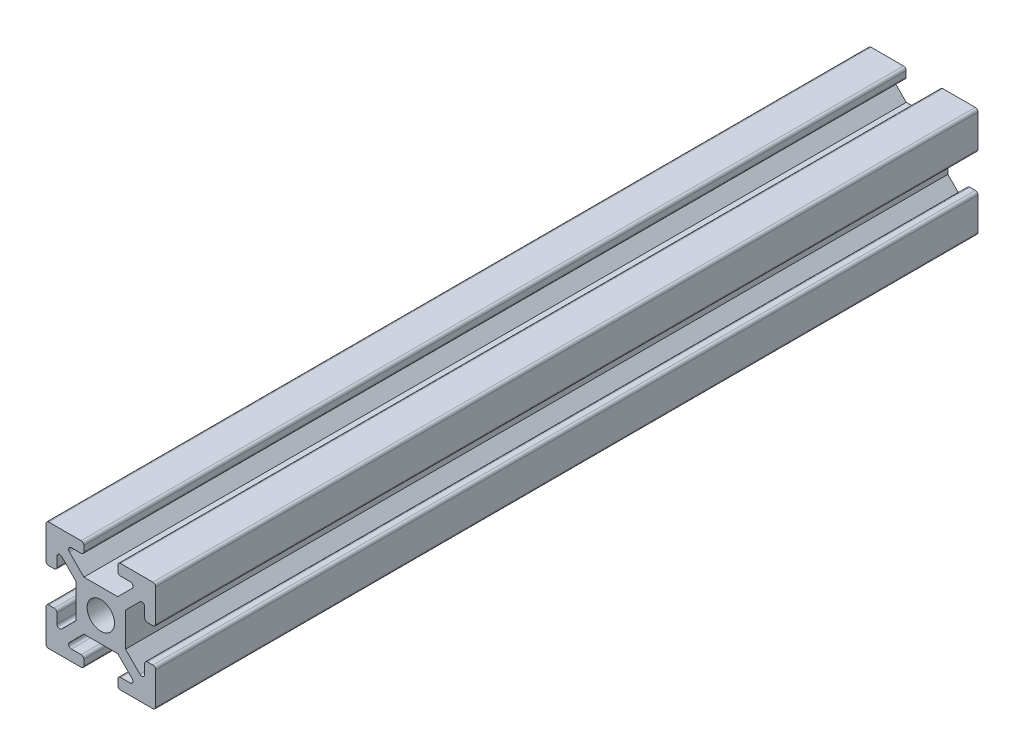
from build123d import *

# Parameters (mm, degrees)
AUFSATZ_LINEAR_AUSTRAGEN1_DEPTH = 150
VERRUNDUNG1_R                   = 0.5
KREISMUSTER1_COUNT              = 4
SKIZZE3_W                       = 9
SKIZZE3_H                       = 9
AUFSATZ_LINEAR_AUSTRAGEN2_DEPTH = 150
SKIZZE4_R                       = 2.5
SCHNITT_LINEAR_AUSTRAGEN1_DEPTH = 151.665191733


with BuildPart() as part:
    # Skizze1 → Aufsatz-Linear austragen1 (new body)
    with BuildSketch(Plane.XY):
        Polygon((-0.707106781, 0.707106781), (6.585786438, 8), (3.1, 8), (3.1, 10), (10, 10), (10, 3.1), (8, 3.1), (8, 6.585786438), (0.707106781, -0.707106781), align=None)
    extrude(amount=AUFSATZ_LINEAR_AUSTRAGEN1_DEPTH)

    # Verrundung1
    verrundung1_edges = [part.edges().sort_by_distance(p)[0] for p in [
        (10, 3.1, 75),
        (8, 3.1, 75),
        (8, 6.585786438, 75),
        (6.585786438, 8, 75),
        (3.1, 8, 75),
        (3.1, 10, 75),
        (10, 10, 75),
    ]]
    fillet(verrundung1_edges, radius=VERRUNDUNG1_R)

    # Kreismuster1: part ×4 about axis
    kreismuster1_axis = Axis((0, 0, 0), (0, 0, 1))


with BuildPart() as part_1:
    add(part.part)
    for i in range(1, KREISMUSTER1_COUNT):
        add(part.part.rotate(kreismuster1_axis, i * 360 / KREISMUSTER1_COUNT))

    # Skizze3 → Aufsatz-Linear austragen2 (add)
    with BuildSketch(Plane.XY.offset(150)):
        Rectangle(SKIZZE3_W, SKIZZE3_H)
    extrude(amount=-AUFSATZ_LINEAR_AUSTRAGEN2_DEPTH)

    # Skizze4 → Schnitt-Linear austragen1 (cut, through all)
    with BuildSketch(Plane.XY.offset(150)):
        Circle(SKIZZE4_R)
    extrude(amount=-SCHNITT_LINEAR_AUSTRAGEN1_DEPTH, mode=Mode.SUBTRACT)


solid = part_1.part
